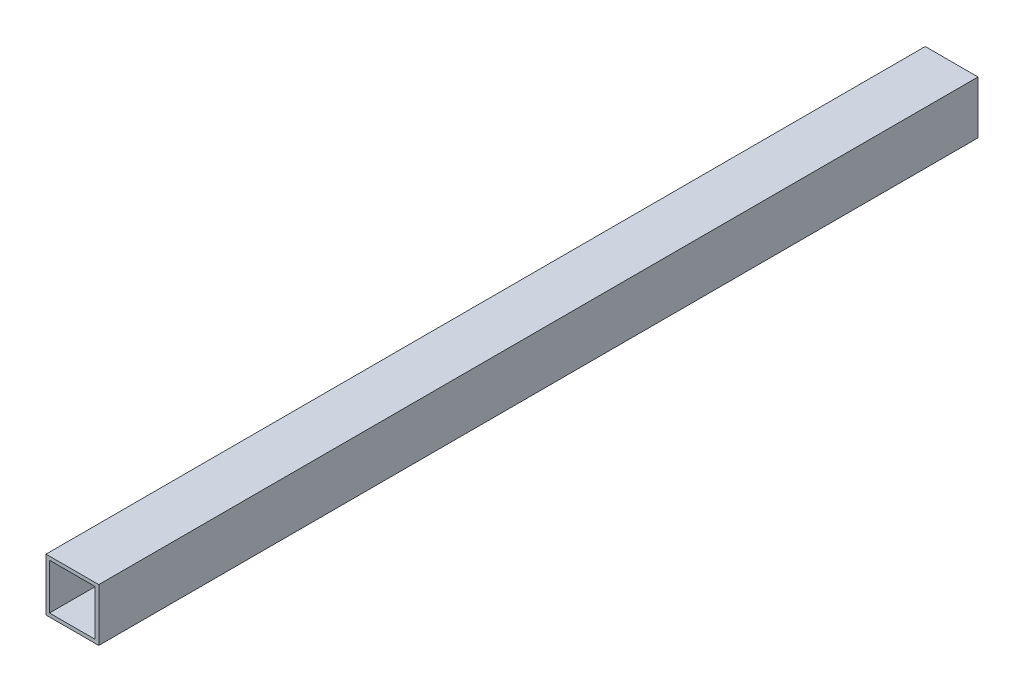
from build123d import *

# Parameters (mm, degrees)
ESBO_O2_W                = 30
ESBO_O2_H                = 30
RESSALTO_EXTRUS_O1_DEPTH = 500
CASCA2_T                 = -2


with BuildPart() as part:
    # Esboço2 → Ressalto-extrusão1 (new body)
    with BuildSketch(Plane.XY):
        with Locations((-79.205213928, 44.662246879)):
            Rectangle(ESBO_O2_W, ESBO_O2_H)
    extrude(amount=RESSALTO_EXTRUS_O1_DEPTH)

    # Casca2
    casca2_openings = [part.faces().sort_by_distance(p)[0] for p in [
        (-79.205213928, 44.662246879, 500),
        (-79.205213928, 44.662246879, 0),
    ]]
    offset(amount=CASCA2_T, openings=casca2_openings, kind=Kind.INTERSECTION)


solid = part.part
